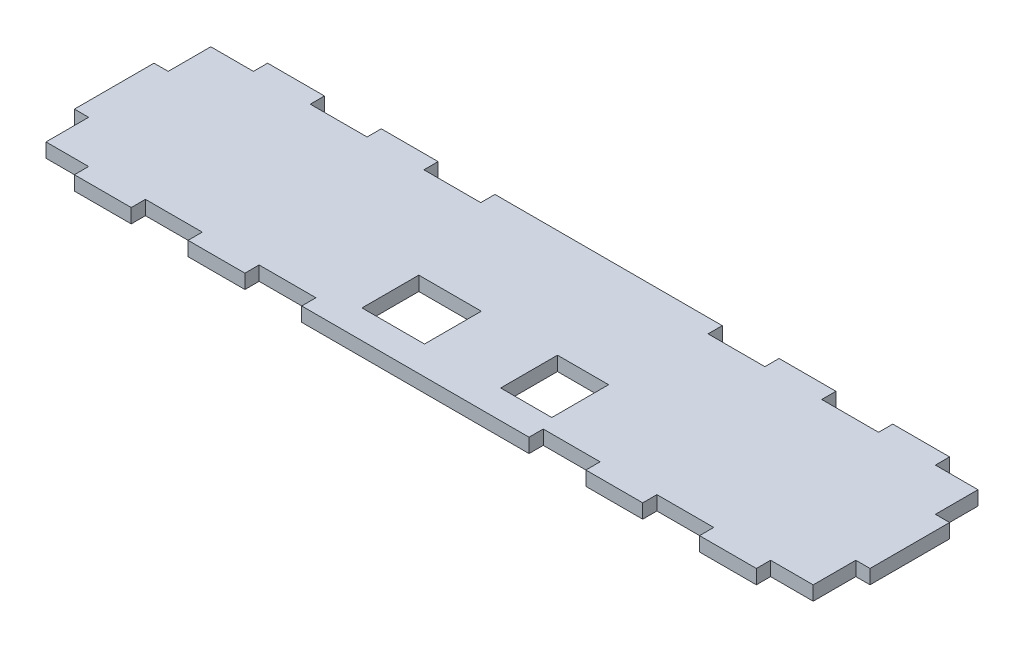
from build123d import *

# Parameters (mm, degrees)
SKETCH1_W           = 171.45
SKETCH1_H           = 36.83
BOSS_EXTRUDE1_DEPTH = 3.175
SKETCH2_W           = 12.7
SKETCH2_H           = 3.175
SKETCH2_W_2         = 50.8
BOSS_EXTRUDE2_DEPTH = 3.175
SKETCH3_W           = 42.418
SKETCH3_H           = 12.7
CUT_EXTRUDE1_DEPTH  = 3.175
SKETCH5_W           = 17.018
SKETCH5_H           = 12.7
BOSS_EXTRUDE3_DEPTH = 3.175
SKETCH6_W           = 3.175
SKETCH6_H           = 17.78
BOSS_EXTRUDE4_DEPTH = 3.175


with BuildPart() as part:
    # Sketch1 → Boss-Extrude1 (new body)
    with BuildSketch(Plane(origin=(0, 0, 0), x_dir=(1, 0, 0), z_dir=(0, 1, 0))):
        with Locations((85.725, 18.415)):
            Rectangle(SKETCH1_W, SKETCH1_H)
    extrude(amount=BOSS_EXTRUDE1_DEPTH)

    # Sketch2 → Boss-Extrude2 (add)
    with BuildSketch(Plane(origin=(0, 3.175, 0), x_dir=(1, 0, 0), z_dir=(0, 1, 0))):
        with Locations((15.875, -1.5875)):
            Rectangle(SKETCH2_W, SKETCH2_H)
        with Locations((41.275, -1.5875)):
            Rectangle(SKETCH2_W, SKETCH2_H)
        with Locations((85.725, -1.5875)):
            Rectangle(SKETCH2_W_2, SKETCH2_H)
        with Locations((130.175, -1.5875)):
            Rectangle(SKETCH2_W, SKETCH2_H)
        with Locations((155.575, -1.5875)):
            Rectangle(SKETCH2_W, SKETCH2_H)
    boss_extrude2 = extrude(amount=-BOSS_EXTRUDE2_DEPTH)

    # Sketch3 → Cut-Extrude1 (cut)
    with BuildSketch(Plane(origin=(0, 3.175, 0), x_dir=(1, 0, 0), z_dir=(0, 1, 0))):
        with Locations((88.646, 9.525)):
            Rectangle(SKETCH3_W, SKETCH3_H)
    extrude(amount=-CUT_EXTRUDE1_DEPTH, mode=Mode.SUBTRACT)

    # Sketch5 → Boss-Extrude3 (add)
    with BuildSketch(Plane(origin=(0, 3.175, 0), x_dir=(1, 0, 0), z_dir=(0, 1, 0))):
        with Locations((89.916, 9.525)):
            Rectangle(SKETCH5_W, SKETCH5_H)
    extrude(amount=-BOSS_EXTRUDE3_DEPTH)

    # Sketch6 → Boss-Extrude4 (add)
    with BuildSketch(Plane(origin=(0, 3.175, 0), x_dir=(1, 0, 0), z_dir=(0, 1, 0))):
        with Locations((-1.5875, 18.415)):
            Rectangle(SKETCH6_W, SKETCH6_H)
        with Locations((173.0375, 18.415)):
            Rectangle(SKETCH6_W, SKETCH6_H)
    extrude(amount=-BOSS_EXTRUDE4_DEPTH)

    # Mirror1: Boss-Extrude2 across plane
    add(boss_extrude2.mirror(Plane(origin=(0, 0, -18.415), x_dir=(1, 0, 0), z_dir=(0, 0, -1))))


solid = part.part
